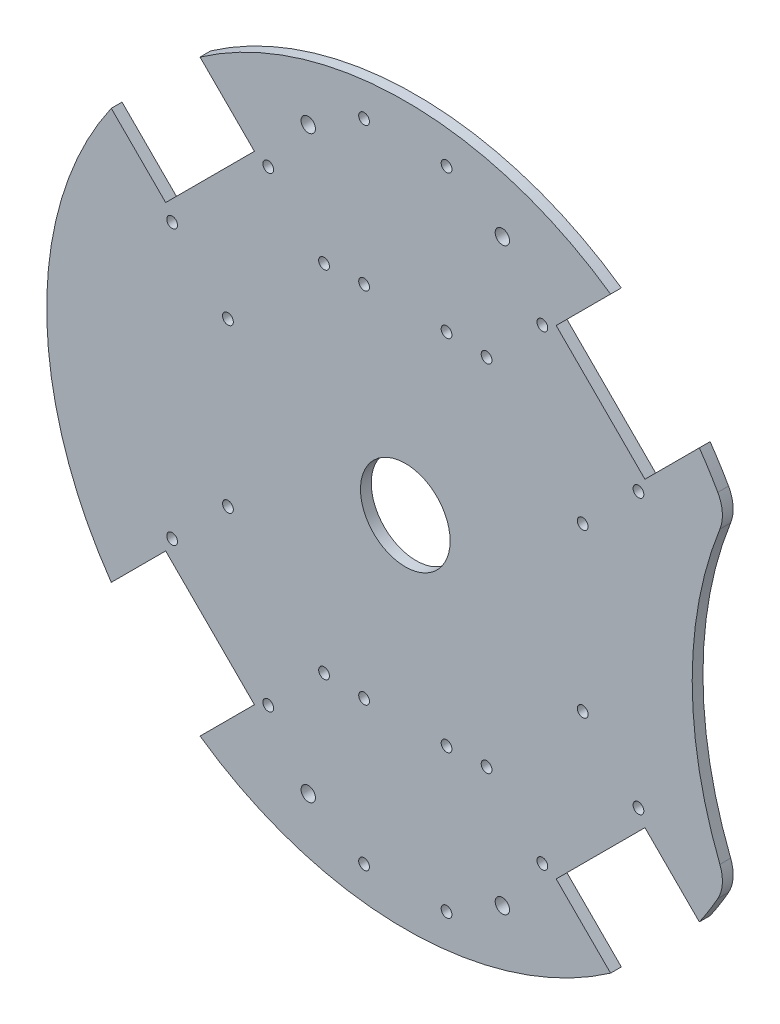
from build123d import *

# Parameters (mm, degrees)
CROQUIS1_R              = 100
SALIENTE_EXTRUIR1_DEPTH = 3
CROQUIS3_R              = 110
CORTAR_EXTRUIR1_DEPTH   = 3
REDONDEO1_R             = 10
CROQUIS4_R              = 1.5
CROQUIS4_R_2            = 12.5
CORTAR_EXTRUIR2_DEPTH   = 142.453172607
CROQUIS5_R              = 1.5
CORTAR_EXTRUIR3_DEPTH   = 142.453172607
CROQUIS7_R              = 2
CORTAR_EXTRUIR5_DEPTH   = 10


with BuildPart() as part:
    # Croquis1 → Saliente-Extruir1 (new body)
    with BuildSketch(Plane.XY):
        Circle(CROQUIS1_R)
    extrude(amount=SALIENTE_EXTRUIR1_DEPTH)

    # Croquis3 → Cortar-Extruir1 (cut)
    with BuildSketch(Plane.XY.offset(3)):
        with Locations((190, 0)):
            Circle(CROQUIS3_R)
    extrude(amount=-CORTAR_EXTRUIR1_DEPTH, mode=Mode.SUBTRACT)

    # Redondeo1
    redondeo1_edges = [part.edges().sort_by_distance(p)[0] for p in [
        (89.473684211, -44.659375654, 1.5),
        (89.473684211, 44.659375654, 1.5),
    ]]
    fillet(redondeo1_edges, radius=REDONDEO1_R)

    # Croquis4 → Cortar-Extruir2 (cut, through all)
    with BuildSketch(Plane.XY.offset(3)):
        with Locations((-65.01846853, -38.219121523)):
            Circle(CROQUIS4_R)
        with Locations((-49.462119344, -22.662772337)):
            Circle(CROQUIS4_R)
        with Locations((-22.662772337, -49.462119344)):
            Circle(CROQUIS4_R)
        with Locations((-38.219121523, -65.01846853)):
            Circle(CROQUIS4_R)
        with Locations((-22.662772337, 49.462119344)):
            Circle(CROQUIS4_R)
        with Locations((-38.219121523, 65.01846853)):
            Circle(CROQUIS4_R)
        with Locations((-49.462119344, 22.662772337)):
            Circle(CROQUIS4_R)
        with Locations((-65.01846853, 38.219121523)):
            Circle(CROQUIS4_R)
        with Locations((49.462119344, 22.662772337)):
            Circle(CROQUIS4_R)
        with Locations((65.01846853, 38.219121523)):
            Circle(CROQUIS4_R)
        with Locations((22.662772337, 49.462119344)):
            Circle(CROQUIS4_R)
        with Locations((38.219121523, 65.01846853)):
            Circle(CROQUIS4_R)
        with Locations((22.662772337, -49.462119344)):
            Circle(CROQUIS4_R)
        with Locations((38.219121523, -65.01846853)):
            Circle(CROQUIS4_R)
        with Locations((49.462119344, -22.662772337)):
            Circle(CROQUIS4_R)
        with Locations((65.01846853, -38.219121523)):
            Circle(CROQUIS4_R)
        Circle(CROQUIS4_R_2)
        Polygon((-58.336309448, -83.085046789), (-83.085046789, -58.336309448), (-66.821590822, -42.072853481), (-42.072853481, -66.821590822), align=None)
        Polygon((-66.821590822, 42.072853481), (-42.072853481, 66.821590822), (-58.336309448, 83.085046789), (-83.085046789, 58.336309448), align=None)
        Polygon((42.072853481, 66.821590822), (66.821590822, 42.072853481), (83.085046789, 58.336309448), (58.336309448, 83.085046789), align=None)
        Polygon((66.821590822, -42.072853481), (42.072853481, -66.821590822), (58.336309448, -83.085046789), (83.085046789, -58.336309448), align=None)
    extrude(amount=-CORTAR_EXTRUIR2_DEPTH, mode=Mode.SUBTRACT)

    # Croquis5 → Cortar-Extruir3 (cut, through all)
    with BuildSketch(Plane(origin=(0, 0, 0), x_dir=(-1, 0, 0), z_dir=(0, 0, -1))):
        with Locations((11.5, -90)):
            Circle(CROQUIS5_R)
        with Locations((-11.5, -90)):
            Circle(CROQUIS5_R)
        with Locations((-11.5, -50)):
            Circle(CROQUIS5_R)
        with Locations((11.5, -50)):
            Circle(CROQUIS5_R)
        with Locations((-11.5, 90)):
            Circle(CROQUIS5_R)
        with Locations((11.5, 90)):
            Circle(CROQUIS5_R)
        with Locations((11.5, 50)):
            Circle(CROQUIS5_R)
        with Locations((-11.5, 50)):
            Circle(CROQUIS5_R)
    extrude(amount=-CORTAR_EXTRUIR3_DEPTH, mode=Mode.SUBTRACT)

    # Croquis7 → Cortar-Extruir5 (cut)
    with BuildSketch(Plane(origin=(0, 0, 0), x_dir=(-1, 0, 0), z_dir=(0, 0, -1))):
        with Locations((-27.065, -80.785)):
            Circle(CROQUIS7_R)
        with Locations((27.065, -80.785)):
            Circle(CROQUIS7_R)
        with Locations(Location((27.065, 80.785, 0), (0, 0, 180))):
            Circle(CROQUIS7_R)
        with Locations(Location((-27.065, 80.785, 0), (0, 0, 180))):
            Circle(CROQUIS7_R)
    extrude(amount=-CORTAR_EXTRUIR5_DEPTH, mode=Mode.SUBTRACT)


solid = part.part
